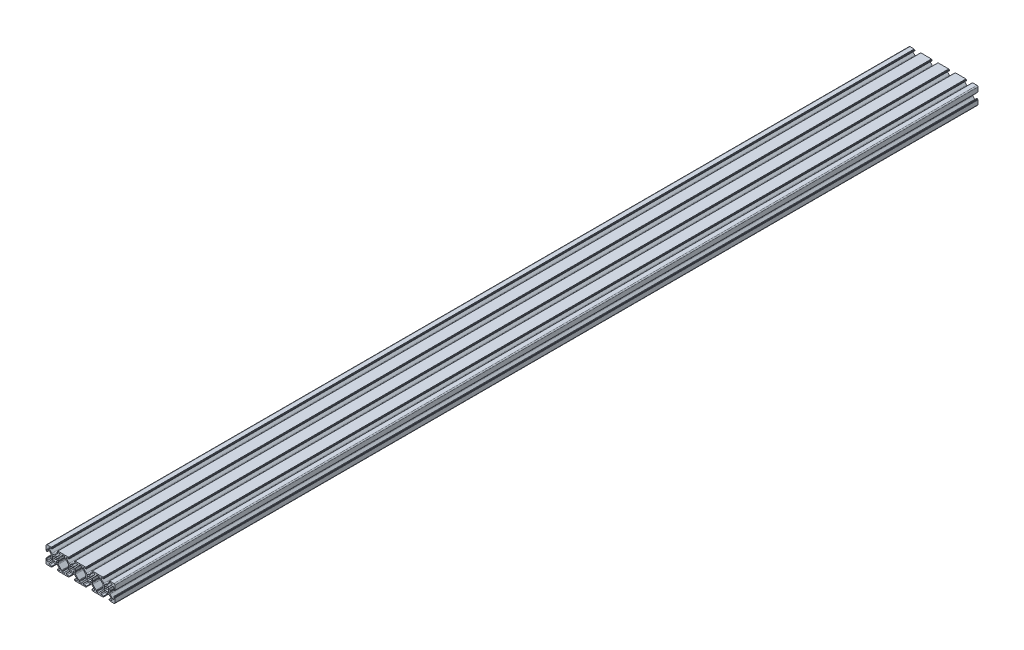
from build123d import *

# Parameters (mm, degrees)
Y_KSEKLIK_EKSTR_ZYON1_DEPTH = 1000


with BuildPart() as part:
    # Model → Yükseklik-Ekstrüzyon1 (new body)
    with BuildSketch(Plane.XY):
        with BuildLine():
            Line((-8.800004195, -10.000004195), (-3.950004195, -10.000004195))
            Line((-3.950004195, -10.000004195), (-3.950004195, -9.499995805))
            Line((-3.950004195, -9.499995805), (-3.147504195, -9.499995805))
            Line((-3.147504195, -9.499995805), (-3.147504195, -8.599995805))
            Line((-3.147504195, -8.599995805), (-5.678683852, -8.599995805))
            ThreePointArc((-5.678683852, -8.599995805), (-6.417787478, -8.106142551), (-6.244369277, -7.23431038))
            Line((-6.244369277, -7.23431038), (-3.178748666, -4.168689769))
            ThreePointArc((-3.178748666, -4.168689769), (-2.455097993, -3.783144936), (-1.639430046, -3.866816407))
            ThreePointArc((-1.639430046, -3.866816407), (-0.978142037, -4.084511985), (-0.289977679, -4.189977678))
            Line((-0.289977679, -4.189977678), (0, -3.9))
            Line((0, -3.9), (0.289977678, -4.189977678))
            ThreePointArc((0.289977678, -4.189977678), (0.978142036, -4.084511985), (1.639430046, -3.866816407))
            ThreePointArc((1.639430046, -3.866816407), (2.453899272, -3.782053175), (3.17678595, -4.166734572))
            Line((3.17678595, -4.166734572), (6.244365517, -7.234314139))
            ThreePointArc((6.244365517, -7.234314139), (6.417783718, -8.10614631), (5.678680092, -8.599999564))
            Line((5.678680092, -8.599999564), (3.147500435, -8.599999564))
            Line((3.147500435, -8.599999564), (3.147500435, -9.499999564))
            Line((3.147500435, -9.499999564), (3.950000435, -9.499999564))
            Line((3.950000435, -9.499999564), (3.950000435, -10.000004195))
            Line((3.950000435, -10.000004195), (16.049995805, -10.000004195))
            Line((16.049995805, -10.000004195), (16.049995805, -9.500000435))
            Line((16.049995805, -9.500000435), (16.852495805, -9.500000435))
            Line((16.852495805, -9.500000435), (16.852495805, -8.599995805))
            Line((16.852495805, -8.599995805), (14.321316148, -8.599995805))
            ThreePointArc((14.321316148, -8.599995805), (13.582212522, -8.106142551), (13.755630723, -7.23431038))
            Line((13.755630723, -7.23431038), (16.821251334, -4.168689769))
            ThreePointArc((16.821251334, -4.168689769), (17.544902007, -3.783144936), (18.360569954, -3.866816407))
            ThreePointArc((18.360569954, -3.866816407), (19.021857963, -4.084511985), (19.710022321, -4.189977678))
            Line((19.710022321, -4.189977678), (20, -3.9))
            Line((20, -3.9), (20.289977678, -4.189977678))
            ThreePointArc((20.289977678, -4.189977678), (20.978142036, -4.084511985), (21.639430046, -3.866816407))
            ThreePointArc((21.639430046, -3.866816407), (22.453899272, -3.782053175), (23.17678595, -4.166734572))
            Line((23.17678595, -4.166734572), (26.244365517, -7.234314139))
            ThreePointArc((26.244365517, -7.234314139), (26.417783718, -8.10614631), (25.678680092, -8.599999564))
            Line((25.678680092, -8.599999564), (23.147500435, -8.599999564))
            Line((23.147500435, -8.599999564), (23.147500435, -9.499999564))
            Line((23.147500435, -9.499999564), (23.950000435, -9.499999564))
            Line((23.950000435, -9.499999564), (23.950000435, -10.000004195))
            Line((23.950000435, -10.000004195), (36.049995805, -10.000004195))
            Line((36.049995805, -10.000004195), (36.049995805, -9.500000435))
            Line((36.049995805, -9.500000435), (36.852495805, -9.500000435))
            Line((36.852495805, -9.500000435), (36.852495805, -8.599995805))
            Line((36.852495805, -8.599995805), (34.321316148, -8.599995805))
            ThreePointArc((34.321316148, -8.599995805), (33.582212522, -8.106142551), (33.755630724, -7.23431038))
            Line((33.755630724, -7.23431038), (36.821251334, -4.168689769))
            ThreePointArc((36.821251334, -4.168689769), (37.544902007, -3.783144936), (38.360569954, -3.866816407))
            ThreePointArc((38.360569954, -3.866816407), (39.021857964, -4.084511985), (39.710022322, -4.189977678))
            Line((39.710022322, -4.189977678), (40, -3.9))
            Line((40, -3.9), (40.289977679, -4.189977678))
            ThreePointArc((40.289977679, -4.189977678), (40.978142037, -4.084511985), (41.639430046, -3.866816407))
            ThreePointArc((41.639430046, -3.866816407), (42.453899273, -3.782053175), (43.17678595, -4.166734572))
            Line((43.17678595, -4.166734572), (46.244365517, -7.234314139))
            ThreePointArc((46.244365517, -7.234314139), (46.417783718, -8.10614631), (45.678680092, -8.599999564))
            Line((45.678680092, -8.599999564), (43.147500436, -8.599999564))
            Line((43.147500436, -8.599999564), (43.147500436, -9.499999564))
            Line((43.147500436, -9.499999564), (43.950000436, -9.499999564))
            Line((43.950000436, -9.499999564), (43.950000436, -10.000004195))
            Line((43.950000436, -10.000004195), (56.049995805, -10.000004195))
            Line((56.049995805, -10.000004195), (56.049995805, -9.500000435))
            Line((56.049995805, -9.500000435), (56.852495805, -9.500000435))
            Line((56.852495805, -9.500000435), (56.852495805, -8.599995805))
            Line((56.852495805, -8.599995805), (54.321316148, -8.599995805))
            ThreePointArc((54.321316148, -8.599995805), (53.582212522, -8.106142551), (53.755630723, -7.23431038))
            Line((53.755630723, -7.23431038), (56.821251334, -4.168689769))
            ThreePointArc((56.821251334, -4.168689769), (57.544902007, -3.783144936), (58.360569954, -3.866816407))
            ThreePointArc((58.360569954, -3.866816407), (59.021857963, -4.084511985), (59.710022322, -4.189977678))
            Line((59.710022322, -4.189977678), (60, -3.9))
            Line((60, -3.9), (60.289977678, -4.189977678))
            ThreePointArc((60.289977678, -4.189977678), (60.978142037, -4.084511985), (61.639430046, -3.866816407))
            ThreePointArc((61.639430046, -3.866816407), (62.453899273, -3.782053175), (63.17678595, -4.166734572))
            Line((63.17678595, -4.166734572), (66.244365517, -7.234314139))
            ThreePointArc((66.244365517, -7.234314139), (66.417783718, -8.10614631), (65.678680092, -8.599999564))
            Line((65.678680092, -8.599999564), (63.147500436, -8.599999564))
            Line((63.147500436, -8.599999564), (63.147500436, -9.499999564))
            Line((63.147500436, -9.499999564), (63.950000436, -9.499999564))
            Line((63.950000436, -9.499999564), (63.950000436, -10.000004195))
            Line((63.950000436, -10.000004195), (68.800000436, -10.000004195))
            ThreePointArc((68.800000436, -10.000004195), (69.648528573, -9.648532332), (70.000000435, -8.800004195))
            Line((70.000000435, -8.800004195), (70.000000435, -3.950004195))
            Line((70.000000435, -3.950004195), (69.499995805, -3.950004195))
            Line((69.499995805, -3.950004195), (69.499995805, -3.147739195))
            Line((69.499995805, -3.147739195), (68.599995805, -3.147739195))
            Line((68.599995805, -3.147739195), (68.599995805, -5.678683851))
            ThreePointArc((68.599995805, -5.678683851), (68.106142551, -6.417787477), (67.23431038, -6.244369276))
            Line((67.23431038, -6.244369276), (64.168689769, -3.178748666))
            ThreePointArc((64.168689769, -3.178748666), (63.783144936, -2.455097993), (63.866816407, -1.639430046))
            ThreePointArc((63.866816407, -1.639430046), (64.084511985, -0.978142036), (64.189977678, -0.289977678))
            Line((64.189977678, -0.289977678), (63.9, 0))
            Line((63.9, 0), (64.189977678, 0.289977678))
            ThreePointArc((64.189977678, 0.289977678), (64.084511985, 0.978142037), (63.866816407, 1.639430046))
            ThreePointArc((63.866816407, 1.639430046), (63.782053175, 2.453899272), (64.166734573, 3.17678595))
            Line((64.166734573, 3.17678595), (67.23431414, 6.244365517))
            ThreePointArc((67.23431414, 6.244365517), (68.106146311, 6.417783718), (68.599999565, 5.678680092))
            Line((68.599999565, 5.678680092), (68.599999565, 3.147500436))
            Line((68.599999565, 3.147500436), (69.500000436, 3.147500436))
            Line((69.500000436, 3.147500436), (69.500000436, 3.949999564))
            Line((69.500000436, 3.949999564), (70.000000435, 3.949999564))
            Line((70.000000435, 3.949999564), (70.000000435, 8.799992045))
            ThreePointArc((70.000000435, 8.799992045), (69.648529902, 9.648522613), (68.800000435, 9.999995805))
            Line((68.800000435, 9.999995805), (63.950000435, 9.999995805))
            Line((63.950000435, 9.999995805), (63.950000435, 9.499999564))
            Line((63.950000435, 9.499999564), (63.147500435, 9.499999564))
            Line((63.147500435, 9.499999564), (63.147500435, 8.599999564))
            Line((63.147500435, 8.599999564), (65.678680092, 8.599999564))
            ThreePointArc((65.678680092, 8.599999564), (66.417783718, 8.10614631), (66.244365517, 7.23431414))
            Line((66.244365517, 7.23431414), (63.17678595, 4.166734573))
            ThreePointArc((63.17678595, 4.166734573), (62.453899272, 3.782053175), (61.639430046, 3.866816407))
            ThreePointArc((61.639430046, 3.866816407), (60.978142037, 4.084511985), (60.289977678, 4.189977678))
            Line((60.289977678, 4.189977678), (60, 3.9))
            Line((60, 3.9), (59.710022322, 4.189977679))
            ThreePointArc((59.710022322, 4.189977679), (59.021857964, 4.084511985), (58.360569954, 3.866816407))
            ThreePointArc((58.360569954, 3.866816407), (57.544902007, 3.783144936), (56.821251334, 4.168689769))
            Line((56.821251334, 4.168689769), (53.755630724, 7.23431038))
            ThreePointArc((53.755630724, 7.23431038), (53.582212522, 8.106142551), (54.321316148, 8.599995805))
            Line((54.321316148, 8.599995805), (56.852500435, 8.599995805))
            Line((56.852500435, 8.599995805), (56.852500435, 9.499995805))
            Line((56.852500435, 9.499995805), (56.050000435, 9.499995805))
            Line((56.050000435, 9.499995805), (56.050000435, 9.999995805))
            Line((56.050000435, 9.999995805), (43.950000436, 9.999995805))
            Line((43.950000436, 9.999995805), (43.950000436, 9.499999564))
            Line((43.950000436, 9.499999564), (43.147500436, 9.499999564))
            Line((43.147500436, 9.499999564), (43.147500436, 8.599999564))
            Line((43.147500436, 8.599999564), (45.678680092, 8.599999564))
            ThreePointArc((45.678680092, 8.599999564), (46.417783718, 8.10614631), (46.244365517, 7.234314139))
            Line((46.244365517, 7.234314139), (43.17678595, 4.166734573))
            ThreePointArc((43.17678595, 4.166734573), (42.453899273, 3.782053175), (41.639430046, 3.866816407))
            ThreePointArc((41.639430046, 3.866816407), (40.978142037, 4.084511985), (40.289977679, 4.189977678))
            Line((40.289977679, 4.189977678), (40, 3.9))
            Line((40, 3.9), (39.710022322, 4.189977678))
            ThreePointArc((39.710022322, 4.189977678), (39.021857964, 4.084511985), (38.360569954, 3.866816407))
            ThreePointArc((38.360569954, 3.866816407), (37.544902007, 3.783144936), (36.821251334, 4.168689769))
            Line((36.821251334, 4.168689769), (33.755630724, 7.23431038))
            ThreePointArc((33.755630724, 7.23431038), (33.582212522, 8.106142551), (34.321316149, 8.599995805))
            Line((34.321316149, 8.599995805), (36.852500436, 8.599995805))
            Line((36.852500436, 8.599995805), (36.852500436, 9.499995805))
            Line((36.852500436, 9.499995805), (36.050000436, 9.499995805))
            Line((36.050000436, 9.499995805), (36.050000436, 9.999995805))
            Line((36.050000436, 9.999995805), (23.950000435, 9.999995805))
            Line((23.950000435, 9.999995805), (23.950000435, 9.499999564))
            Line((23.950000435, 9.499999564), (23.147500435, 9.499999564))
            Line((23.147500435, 9.499999564), (23.147500435, 8.599999564))
            Line((23.147500435, 8.599999564), (25.678680092, 8.599999564))
            ThreePointArc((25.678680092, 8.599999564), (26.417783718, 8.10614631), (26.244365517, 7.234314139))
            Line((26.244365517, 7.234314139), (23.17678595, 4.166734573))
            ThreePointArc((23.17678595, 4.166734573), (22.453899272, 3.782053175), (21.639430046, 3.866816407))
            ThreePointArc((21.639430046, 3.866816407), (20.978142036, 4.084511985), (20.289977678, 4.189977678))
            Line((20.289977678, 4.189977678), (20, 3.9))
            Line((20, 3.9), (19.710022321, 4.189977678))
            ThreePointArc((19.710022321, 4.189977678), (19.021857963, 4.084511985), (18.360569954, 3.866816407))
            ThreePointArc((18.360569954, 3.866816407), (17.544902007, 3.783144936), (16.821251334, 4.168689769))
            Line((16.821251334, 4.168689769), (13.755630723, 7.23431038))
            ThreePointArc((13.755630723, 7.23431038), (13.582212522, 8.106142551), (14.321316148, 8.599995805))
            Line((14.321316148, 8.599995805), (16.852500435, 8.599995805))
            Line((16.852500435, 8.599995805), (16.852500435, 9.499995805))
            Line((16.852500435, 9.499995805), (16.050000435, 9.499995805))
            Line((16.050000435, 9.499995805), (16.050000435, 9.999995805))
            Line((16.050000435, 9.999995805), (3.950000435, 9.999995805))
            Line((3.950000435, 9.999995805), (3.950000435, 9.499999565))
            Line((3.950000435, 9.499999565), (3.147500435, 9.499999565))
            Line((3.147500435, 9.499999565), (3.147500435, 8.599999565))
            Line((3.147500435, 8.599999565), (5.678680092, 8.599999565))
            ThreePointArc((5.678680092, 8.599999565), (6.417783718, 8.10614631), (6.244365517, 7.23431414))
            Line((6.244365517, 7.23431414), (3.17678595, 4.166734573))
            ThreePointArc((3.17678595, 4.166734573), (2.453899272, 3.782053175), (1.639430046, 3.866816407))
            ThreePointArc((1.639430046, 3.866816407), (0.978142036, 4.084511985), (0.289977678, 4.189977679))
            Line((0.289977678, 4.189977679), (0, 3.9))
            Line((0, 3.9), (-0.289977679, 4.189977678))
            ThreePointArc((-0.289977679, 4.189977678), (-0.978142037, 4.084511985), (-1.639430046, 3.866816407))
            ThreePointArc((-1.639430046, 3.866816407), (-2.455097993, 3.783144936), (-3.178748666, 4.168689769))
            Line((-3.178748666, 4.168689769), (-6.244369277, 7.23431038))
            ThreePointArc((-6.244369277, 7.23431038), (-6.417787478, 8.106142551), (-5.678683852, 8.599995805))
            Line((-5.678683852, 8.599995805), (-3.147504195, 8.599995805))
            Line((-3.147504195, 8.599995805), (-3.147504195, 9.499995805))
            Line((-3.147504195, 9.499995805), (-3.950004195, 9.499995805))
            Line((-3.950004195, 9.499995805), (-3.950004195, 9.999995805))
            Line((-3.950004195, 9.999995805), (-8.800004195, 9.999995805))
            ThreePointArc((-8.800004195, 9.999995805), (-9.648532333, 9.648523942), (-10.000004195, 8.799995805))
            Line((-10.000004195, 8.799995805), (-10.000004195, 3.949995805))
            Line((-10.000004195, 3.949995805), (-9.500004195, 3.949995805))
            Line((-9.500004195, 3.949995805), (-9.500004195, 3.147495805))
            Line((-9.500004195, 3.147495805), (-8.599999564, 3.147495805))
            Line((-8.599999564, 3.147495805), (-8.599999564, 5.678680092))
            ThreePointArc((-8.599999564, 5.678680092), (-8.10614631, 6.417783718), (-7.234314139, 6.244365517))
            Line((-7.234314139, 6.244365517), (-4.166734573, 3.17678595))
            ThreePointArc((-4.166734573, 3.17678595), (-3.782053175, 2.453899272), (-3.866816407, 1.639430046))
            ThreePointArc((-3.866816407, 1.639430046), (-4.084511985, 0.978142037), (-4.189977678, 0.289977678))
            Line((-4.189977678, 0.289977678), (-3.9, 0))
            Line((-3.9, 0), (-4.189977678, -0.289977678))
            ThreePointArc((-4.189977678, -0.289977678), (-4.084511985, -0.978142036), (-3.866816407, -1.639430046))
            ThreePointArc((-3.866816407, -1.639430046), (-3.783144936, -2.455097993), (-4.168689769, -3.178748666))
            Line((-4.168689769, -3.178748666), (-7.23431038, -6.244369276))
            ThreePointArc((-7.23431038, -6.244369276), (-8.106142551, -6.417787477), (-8.599995805, -5.678683851))
            Line((-8.599995805, -5.678683851), (-8.599995805, -3.147504195))
            Line((-8.599995805, -3.147504195), (-9.499995805, -3.147504195))
            Line((-9.499995805, -3.147504195), (-9.499995805, -3.950004195))
            Line((-9.499995805, -3.950004195), (-10.000004195, -3.950004195))
            Line((-10.000004195, -3.950004195), (-10.000004195, -8.800004195))
            ThreePointArc((-10.000004195, -8.800004195), (-9.648532333, -9.648532332), (-8.800004195, -10.000004195))
        make_face()
        with BuildLine():
            Line((62.140364299, 1.291836162), (62.474873734, 1.626345597))
            ThreePointArc((62.474873734, 1.626345597), (62.474873734, 2.474873734), (61.626345597, 2.474873734))
            Line((61.626345597, 2.474873734), (61.291836161, 2.140364299))
            ThreePointArc((61.291836161, 2.140364299), (60, 2.5), (58.708163839, 2.140364299))
            Line((58.708163839, 2.140364299), (58.373654403, 2.474873734))
            ThreePointArc((58.373654403, 2.474873734), (57.525126266, 2.474873734), (57.525126266, 1.626345597))
            Line((57.525126266, 1.626345597), (57.859635701, 1.291836162))
            ThreePointArc((57.859635701, 1.291836162), (57.5, 0), (57.859635701, -1.291836161))
            Line((57.859635701, -1.291836161), (57.525126266, -1.626345597))
            ThreePointArc((57.525126266, -1.626345597), (57.525126266, -2.474873734), (58.373654403, -2.474873734))
            Line((58.373654403, -2.474873734), (58.708163839, -2.140364299))
            ThreePointArc((58.708163839, -2.140364299), (60, -2.5), (61.291836162, -2.140364299))
            Line((61.291836162, -2.140364299), (61.626345597, -2.474873734))
            ThreePointArc((61.626345597, -2.474873734), (62.474873734, -2.474873734), (62.474873734, -1.626345597))
            Line((62.474873734, -1.626345597), (62.140364299, -1.291836161))
            ThreePointArc((62.140364299, -1.291836161), (62.5, 0), (62.140364299, 1.291836162))
        make_face(mode=Mode.SUBTRACT)
        with BuildLine():
            Line((55.834194285, -3.175856222), (51.989949494, -7.020101012))
            ThreePointArc((51.989949494, -7.020101012), (51.773176743, -7.344524361), (51.697056275, -7.727207794))
            Line((51.697056275, -7.727207794), (51.697056275, -8.1))
            ThreePointArc((51.697056275, -8.1), (51.550609666, -8.453553391), (51.197056275, -8.6))
            Line((51.197056275, -8.6), (48.802943725, -8.6))
            ThreePointArc((48.802943725, -8.6), (48.449390335, -8.453553391), (48.302943725, -8.1))
            Line((48.302943725, -8.1), (48.302943725, -7.727207794))
            ThreePointArc((48.302943725, -7.727207794), (48.226823258, -7.344524362), (48.010050506, -7.020101013))
            Line((48.010050506, -7.020101013), (44.165805715, -3.175856222))
            ThreePointArc((44.165805715, -3.175856222), (43.781533861, -2.453330896), (43.866816407, -1.639430046))
            ThreePointArc((43.866816407, -1.639430046), (44.084511985, -0.978142037), (44.189977678, -0.289977678))
            Line((44.189977678, -0.289977678), (43.9, 0))
            Line((43.9, 0), (44.189977678, 0.289977678))
            ThreePointArc((44.189977678, 0.289977678), (44.084511985, 0.978142037), (43.866816407, 1.639430046))
            ThreePointArc((43.866816407, 1.639430046), (43.781533861, 2.453330896), (44.165805715, 3.175856222))
            Line((44.165805715, 3.175856222), (48.010050506, 7.020101013))
            ThreePointArc((48.010050506, 7.020101013), (48.226823258, 7.344524362), (48.302943725, 7.727207794))
            Line((48.302943725, 7.727207794), (48.302943725, 8.1))
            ThreePointArc((48.302943725, 8.1), (48.449390335, 8.453553391), (48.802943725, 8.6))
            Line((48.802943725, 8.6), (51.197056275, 8.6))
            ThreePointArc((51.197056275, 8.6), (51.550609665, 8.453553391), (51.697056275, 8.1))
            Line((51.697056275, 8.1), (51.697056275, 7.727207794))
            ThreePointArc((51.697056275, 7.727207794), (51.773176742, 7.344524361), (51.989949494, 7.020101013))
            Line((51.989949494, 7.020101013), (55.834194285, 3.175856222))
            ThreePointArc((55.834194285, 3.175856222), (56.218466139, 2.453330896), (56.133183593, 1.639430046))
            ThreePointArc((56.133183593, 1.639430046), (55.915488015, 0.978142037), (55.810022322, 0.289977678))
            Line((55.810022322, 0.289977678), (56.1, 0))
            Line((56.1, 0), (55.810022322, -0.289977678))
            ThreePointArc((55.810022322, -0.289977678), (55.915488015, -0.978142037), (56.133183593, -1.639430046))
            ThreePointArc((56.133183593, -1.639430046), (56.218466139, -2.453330896), (55.834194285, -3.175856222))
        make_face(mode=Mode.SUBTRACT)
        with BuildLine():
            Line((-2.140364299, 1.291836161), (-2.474873734, 1.626345597))
            ThreePointArc((-2.474873734, 1.626345597), (-2.474873734, 2.474873734), (-1.626345597, 2.474873734))
            Line((-1.626345597, 2.474873734), (-1.291836161, 2.140364299))
            ThreePointArc((-1.291836161, 2.140364299), (0, 2.5), (1.291836161, 2.140364299))
            Line((1.291836161, 2.140364299), (1.626345596, 2.474873734))
            ThreePointArc((1.626345596, 2.474873734), (2.474873734, 2.474873734), (2.474873734, 1.626345597))
            Line((2.474873734, 1.626345597), (2.140364299, 1.291836162))
            ThreePointArc((2.140364299, 1.291836162), (2.5, 0), (2.140364299, -1.291836161))
            Line((2.140364299, -1.291836161), (2.474873734, -1.626345597))
            ThreePointArc((2.474873734, -1.626345597), (2.474873734, -2.474873734), (1.626345597, -2.474873734))
            Line((1.626345597, -2.474873734), (1.291836161, -2.140364299))
            ThreePointArc((1.291836161, -2.140364299), (0, -2.5), (-1.291836162, -2.140364299))
            Line((-1.291836162, -2.140364299), (-1.626345597, -2.474873734))
            ThreePointArc((-1.626345597, -2.474873734), (-2.474873734, -2.474873734), (-2.474873734, -1.626345597))
            Line((-2.474873734, -1.626345597), (-2.140364299, -1.291836161))
            ThreePointArc((-2.140364299, -1.291836161), (-2.5, 0), (-2.140364299, 1.291836161))
        make_face(mode=Mode.SUBTRACT)
        with BuildLine():
            Line((4.165805715, -3.175856222), (8.010050506, -7.020101012))
            ThreePointArc((8.010050506, -7.020101012), (8.226823257, -7.344524361), (8.302943725, -7.727207794))
            Line((8.302943725, -7.727207794), (8.302943725, -8.1))
            ThreePointArc((8.302943725, -8.1), (8.449390334, -8.45355339), (8.802943725, -8.6))
            Line((8.802943725, -8.6), (11.197056275, -8.6))
            ThreePointArc((11.197056275, -8.6), (11.550609665, -8.453553391), (11.697056275, -8.1))
            Line((11.697056275, -8.1), (11.697056275, -7.727207794))
            ThreePointArc((11.697056275, -7.727207794), (11.773176742, -7.344524362), (11.989949494, -7.020101013))
            Line((11.989949494, -7.020101013), (15.834194285, -3.175856222))
            ThreePointArc((15.834194285, -3.175856222), (16.218466139, -2.453330896), (16.133183593, -1.639430046))
            ThreePointArc((16.133183593, -1.639430046), (15.915488015, -0.978142037), (15.810022322, -0.289977678))
            Line((15.810022322, -0.289977678), (16.1, 0))
            Line((16.1, 0), (15.810022321, 0.289977678))
            ThreePointArc((15.810022321, 0.289977678), (15.915488015, 0.978142037), (16.133183593, 1.639430046))
            ThreePointArc((16.133183593, 1.639430046), (16.218466139, 2.453330896), (15.834194284, 3.175856222))
            Line((15.834194284, 3.175856222), (11.989949494, 7.020101013))
            ThreePointArc((11.989949494, 7.020101013), (11.773176742, 7.344524362), (11.697056275, 7.727207794))
            Line((11.697056275, 7.727207794), (11.697056275, 8.1))
            ThreePointArc((11.697056275, 8.1), (11.550609665, 8.453553391), (11.197056275, 8.6))
            Line((11.197056275, 8.6), (8.802943725, 8.6))
            ThreePointArc((8.802943725, 8.6), (8.449390334, 8.453553391), (8.302943725, 8.1))
            Line((8.302943725, 8.1), (8.302943725, 7.727207794))
            ThreePointArc((8.302943725, 7.727207794), (8.226823258, 7.344524362), (8.010050506, 7.020101013))
            Line((8.010050506, 7.020101013), (4.165805715, 3.175856222))
            ThreePointArc((4.165805715, 3.175856222), (3.78153386, 2.453330896), (3.866816407, 1.639430046))
            ThreePointArc((3.866816407, 1.639430046), (4.084511985, 0.978142037), (4.189977678, 0.289977678))
            Line((4.189977678, 0.289977678), (3.9, 0))
            Line((3.9, 0), (4.189977678, -0.289977678))
            ThreePointArc((4.189977678, -0.289977678), (4.084511985, -0.978142037), (3.866816407, -1.639430046))
            ThreePointArc((3.866816407, -1.639430046), (3.781533861, -2.453330896), (4.165805715, -3.175856222))
        make_face(mode=Mode.SUBTRACT)
        with BuildLine():
            Line((17.859635701, 1.291836161), (17.525126266, 1.626345597))
            ThreePointArc((17.525126266, 1.626345597), (17.525126266, 2.474873734), (18.373654403, 2.474873734))
            Line((18.373654403, 2.474873734), (18.708163838, 2.140364299))
            ThreePointArc((18.708163838, 2.140364299), (20, 2.5), (21.291836161, 2.140364299))
            Line((21.291836161, 2.140364299), (21.626345597, 2.474873734))
            ThreePointArc((21.626345597, 2.474873734), (22.474873734, 2.474873734), (22.474873734, 1.626345597))
            Line((22.474873734, 1.626345597), (22.140364299, 1.291836161))
            ThreePointArc((22.140364299, 1.291836161), (22.5, 0), (22.140364299, -1.291836161))
            Line((22.140364299, -1.291836161), (22.474873734, -1.626345597))
            ThreePointArc((22.474873734, -1.626345597), (22.474873734, -2.474873734), (21.626345597, -2.474873734))
            Line((21.626345597, -2.474873734), (21.291836161, -2.140364299))
            ThreePointArc((21.291836161, -2.140364299), (20, -2.5), (18.708163838, -2.140364299))
            Line((18.708163838, -2.140364299), (18.373654403, -2.474873734))
            ThreePointArc((18.373654403, -2.474873734), (17.525126266, -2.474873734), (17.525126266, -1.626345597))
            Line((17.525126266, -1.626345597), (17.859635701, -1.291836161))
            ThreePointArc((17.859635701, -1.291836161), (17.5, 0), (17.859635701, 1.291836161))
        make_face(mode=Mode.SUBTRACT)
        with BuildLine():
            Line((37.859635701, 1.291836161), (37.525126266, 1.626345597))
            ThreePointArc((37.525126266, 1.626345597), (37.525126266, 2.474873734), (38.373654403, 2.474873734))
            Line((38.373654403, 2.474873734), (38.708163839, 2.140364299))
            ThreePointArc((38.708163839, 2.140364299), (40, 2.5), (41.291836162, 2.140364299))
            Line((41.291836162, 2.140364299), (41.626345597, 2.474873734))
            ThreePointArc((41.626345597, 2.474873734), (42.474873734, 2.474873734), (42.474873734, 1.626345597))
            Line((42.474873734, 1.626345597), (42.140364299, 1.291836161))
            ThreePointArc((42.140364299, 1.291836161), (42.5, 0), (42.140364299, -1.291836161))
            Line((42.140364299, -1.291836161), (42.474873734, -1.626345597))
            ThreePointArc((42.474873734, -1.626345597), (42.474873734, -2.474873734), (41.626345597, -2.474873734))
            Line((41.626345597, -2.474873734), (41.291836162, -2.140364299))
            ThreePointArc((41.291836162, -2.140364299), (40, -2.5), (38.708163839, -2.140364299))
            Line((38.708163839, -2.140364299), (38.373654403, -2.474873734))
            ThreePointArc((38.373654403, -2.474873734), (37.525126266, -2.474873734), (37.525126266, -1.626345597))
            Line((37.525126266, -1.626345597), (37.859635701, -1.291836161))
            ThreePointArc((37.859635701, -1.291836161), (37.5, 0), (37.859635701, 1.291836161))
        make_face(mode=Mode.SUBTRACT)
        with BuildLine():
            Line((24.165805716, -3.175856222), (28.010050507, -7.020101013))
            ThreePointArc((28.010050507, -7.020101013), (28.226823258, -7.344524362), (28.302943726, -7.727207794))
            Line((28.302943726, -7.727207794), (28.302943726, -8.1))
            ThreePointArc((28.302943726, -8.1), (28.449390335, -8.453553391), (28.802943726, -8.6))
            Line((28.802943726, -8.6), (31.197056275, -8.6))
            ThreePointArc((31.197056275, -8.6), (31.550609666, -8.453553391), (31.697056275, -8.1))
            Line((31.697056275, -8.1), (31.697056275, -7.727207794))
            ThreePointArc((31.697056275, -7.727207794), (31.773176743, -7.344524362), (31.989949494, -7.020101013))
            Line((31.989949494, -7.020101013), (35.834194285, -3.175856222))
            ThreePointArc((35.834194285, -3.175856222), (36.21846614, -2.453330896), (36.133183594, -1.639430046))
            ThreePointArc((36.133183594, -1.639430046), (35.915488015, -0.978142037), (35.810022322, -0.289977678))
            Line((35.810022322, -0.289977678), (36.1, 0))
            Line((36.1, 0), (35.810022322, 0.289977678))
            ThreePointArc((35.810022322, 0.289977678), (35.915488015, 0.978142037), (36.133183594, 1.639430046))
            ThreePointArc((36.133183594, 1.639430046), (36.21846614, 2.453330896), (35.834194285, 3.175856222))
            Line((35.834194285, 3.175856222), (31.989949494, 7.020101013))
            ThreePointArc((31.989949494, 7.020101013), (31.773176743, 7.344524362), (31.697056275, 7.727207794))
            Line((31.697056275, 7.727207794), (31.697056275, 8.1))
            ThreePointArc((31.697056275, 8.1), (31.550609666, 8.453553391), (31.197056275, 8.6))
            Line((31.197056275, 8.6), (28.802943725, 8.6))
            ThreePointArc((28.802943725, 8.6), (28.449390335, 8.453553391), (28.302943725, 8.1))
            Line((28.302943725, 8.1), (28.302943725, 7.727207794))
            ThreePointArc((28.302943725, 7.727207794), (28.226823258, 7.344524361), (28.010050507, 7.020101013))
            Line((28.010050507, 7.020101013), (24.165805716, 3.175856222))
            ThreePointArc((24.165805716, 3.175856222), (23.781533861, 2.453330896), (23.866816407, 1.639430046))
            ThreePointArc((23.866816407, 1.639430046), (24.084511985, 0.978142037), (24.189977679, 0.289977678))
            Line((24.189977679, 0.289977678), (23.9, 0))
            Line((23.9, 0), (24.189977679, -0.289977678))
            ThreePointArc((24.189977679, -0.289977678), (24.084511985, -0.978142037), (23.866816407, -1.639430046))
            ThreePointArc((23.866816407, -1.639430046), (23.781533861, -2.453330896), (24.165805716, -3.175856222))
        make_face(mode=Mode.SUBTRACT)
    extrude(amount=-Y_KSEKLIK_EKSTR_ZYON1_DEPTH)


solid = part.part
